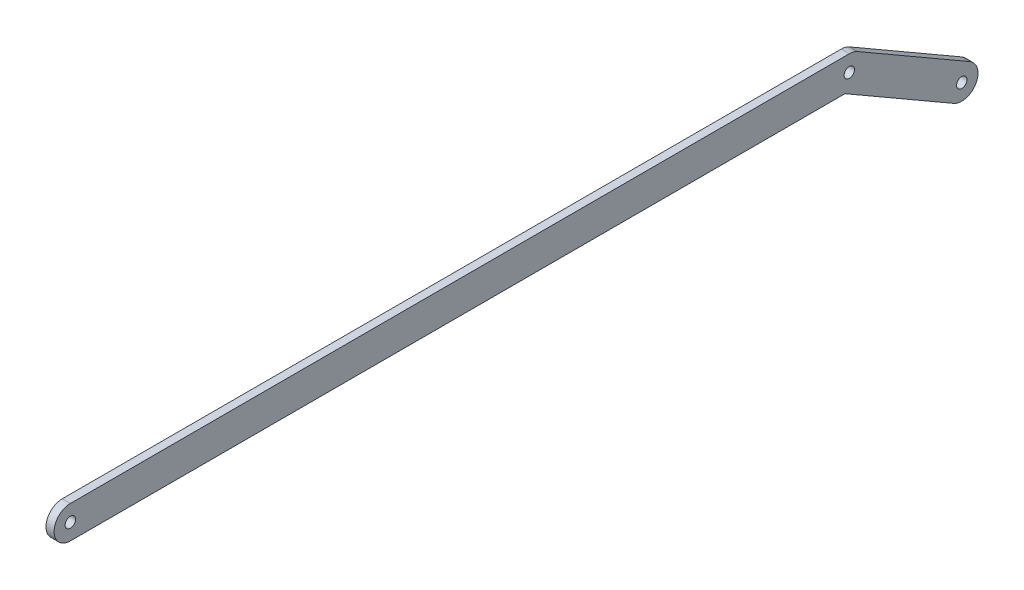
from build123d import *

# Parameters (mm, degrees)
SKETCH1_R           = 2.032
BOSS_EXTRUDE1_DEPTH = 3.175


with BuildPart() as part:
    # Sketch1 → Boss-Extrude1 (new body)
    # profile 1 of 3: a face of its own
    with BuildSketch(Plane(origin=(0, 0, 0), x_dir=(0, 0, -1), z_dir=(1, 0, 0))):
        with BuildLine():
            Line((47.169090512, -19.900738686), (3.175, 5.499261314))
            ThreePointArc((3.175, 5.499261314), (6.133628997, -1.643500936), (0, -6.35))
            Line((0, -6.35), (-1.701477372, -6.35))
            Line((-1.701477372, -6.35), (40.819090512, -30.899261314))
            ThreePointArc((40.819090512, -30.899261314), (49.493351826, -28.575), (47.169090512, -19.900738686))
        make_face()
        with Locations((43.994090512, -25.4)):
            Circle(SKETCH1_R, mode=Mode.SUBTRACT)
    # profile 2 of 3: a face of its own
    with BuildSketch(Plane(origin=(0, 0, 0), x_dir=(0, 0, -1), z_dir=(1, 0, 0))):
        with BuildLine():
            ThreePointArc((0, -6.35), (6.133628997, -1.643500936), (3.175, 5.499261314))
            ThreePointArc((3.175, 5.499261314), (1.643500936, 6.133628997), (0, 6.35))
            ThreePointArc((0, 6.35), (-6.133628997, 1.643500936), (-3.175, -5.499261314))
            Line((-3.175, -5.499261314), (-1.701477372, -6.35))
            Line((-1.701477372, -6.35), (0, -6.35))
        make_face()
        Circle(SKETCH1_R, mode=Mode.SUBTRACT)
    # profile 3 of 3: a face of its own
    with BuildSketch(Plane(origin=(0, 0, 0), x_dir=(0, 0, -1), z_dir=(1, 0, 0))):
        with BuildLine():
            ThreePointArc((-3.175, -5.499261314), (-6.133628997, 1.643500936), (0, 6.35))
            Line((0, 6.35), (-304.8, 6.35))
            ThreePointArc((-304.8, 6.35), (-311.15, 0), (-304.8, -6.35))
            Line((-304.8, -6.35), (-1.701477372, -6.35))
            Line((-1.701477372, -6.35), (-3.175, -5.499261314))
        make_face()
        with Locations((-304.8, 0)):
            Circle(SKETCH1_R, mode=Mode.SUBTRACT)
    extrude(amount=BOSS_EXTRUDE1_DEPTH)


solid = part.part
